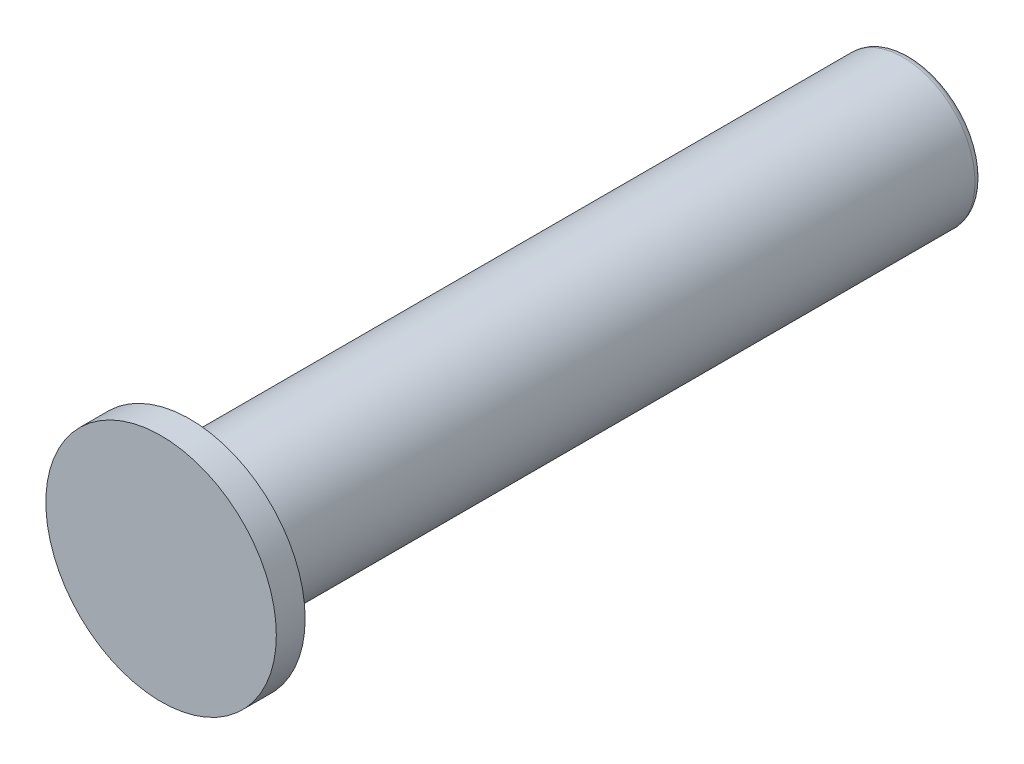
from build123d import *

# Parameters (mm, degrees)
SKETCH1_R           = 5
BOSS_EXTRUDE1_DEPTH = 25
FILLET3_R           = 0.5
BOSS_EXTRUDE2_START = 25
SKETCH2_R           = 8
BOSS_EXTRUDE2_DEPTH = 2


with BuildPart() as part:
    # Sketch1 → Boss-Extrude1 (new, symmetric)
    with BuildSketch(Plane.XY):
        Circle(SKETCH1_R)
    extrude(amount=BOSS_EXTRUDE1_DEPTH, both=True)

    # Fillet3
    fillet3_edges = [part.edges().sort_by_distance(p)[0] for p in [
        (-5, 0, -25),
    ]]
    fillet(fillet3_edges, radius=FILLET3_R)

    # Sketch2 → Boss-Extrude2 (add)
    with BuildSketch(Plane.XY.offset(BOSS_EXTRUDE2_START)):
        Circle(SKETCH2_R)
    extrude(amount=BOSS_EXTRUDE2_DEPTH)


solid = part.part
